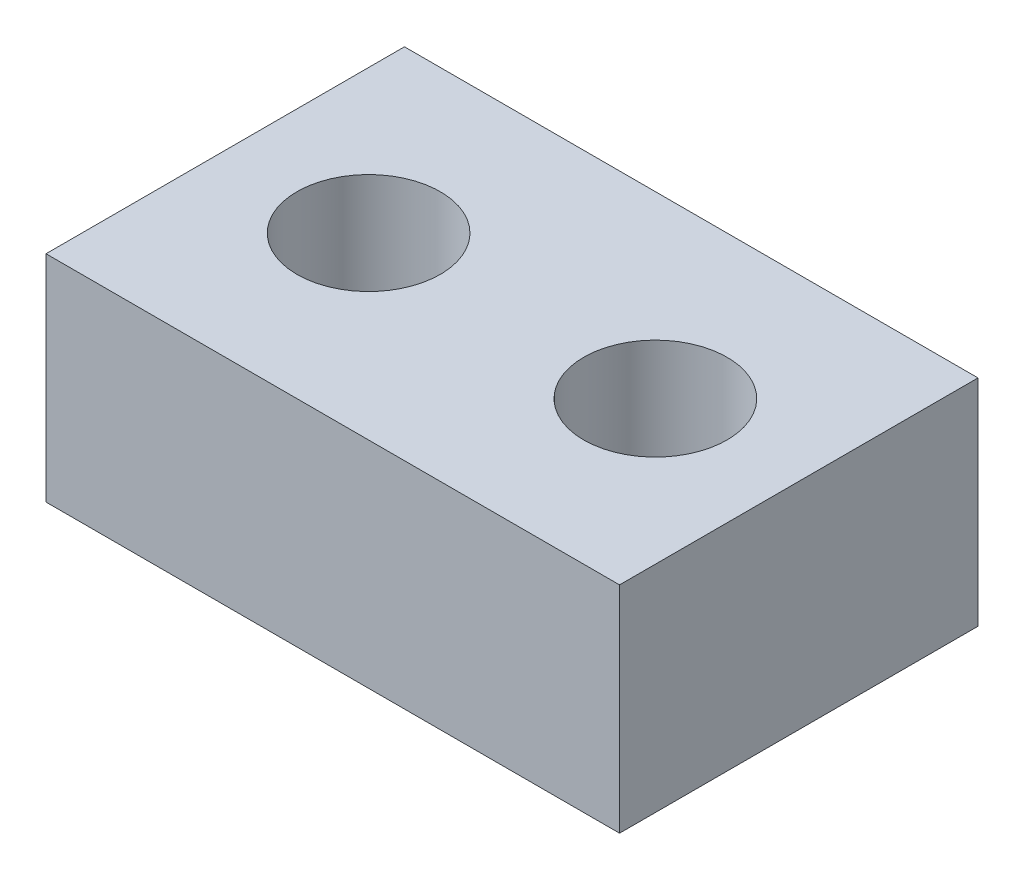
from build123d import *

# Parameters (mm, degrees)
SKETCH_1_W      = 80
SKETCH_1_H      = 50
SKETCH_1_R      = 10
EXTRUDE_1_DEPTH = 30


with BuildPart() as part:
    # 스케치1 → 보스-돌출1 (new body)
    with BuildSketch(Plane(origin=(0, 0, 0), x_dir=(1, 0, 0), z_dir=(0, 1, 0))):
        with Locations((-15.412147326, -3.185832514)):
            Rectangle(SKETCH_1_W, SKETCH_1_H)
        with Locations(Location((-35.412147326, -3.185832514, 0), (0, 0, 270))):
            Circle(SKETCH_1_R, mode=Mode.SUBTRACT)
        with Locations(Location((4.587852674, -3.185832514, 0), (0, 0, 270))):
            Circle(SKETCH_1_R, mode=Mode.SUBTRACT)
    extrude(amount=EXTRUDE_1_DEPTH)


solid = part.part
